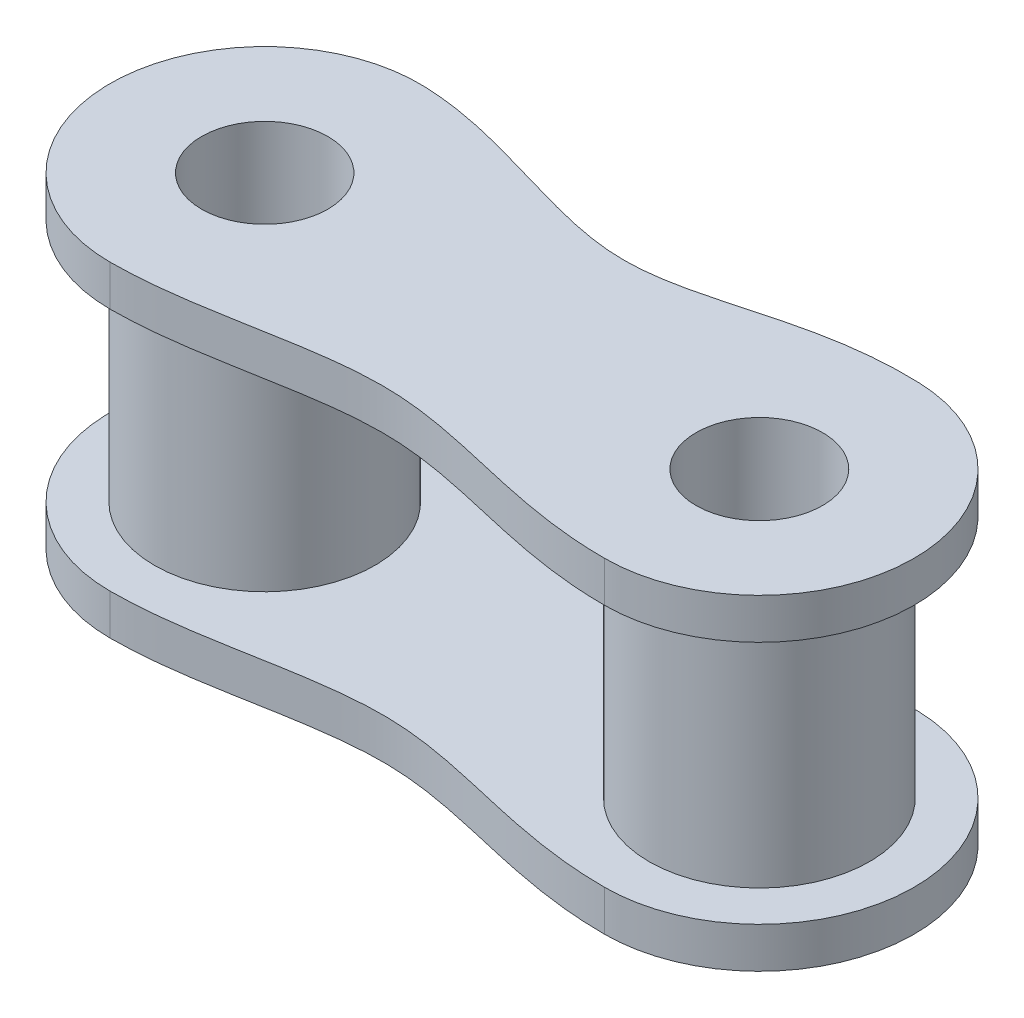
from build123d import *

# Parameters (mm, degrees)
EXTRUDE_8_DEPTH          = 3
EXTRUDE_8_DEPTH_BACK     = 3
SKETCH_3_R               = 2.708293856
EXTRUDE_8_2_DEPTH        = 3
EXTRUDE_8_2_DEPTH_BACK   = 3
CUT_EXTRUDE_1_DEPTH      = 3
CUT_EXTRUDE_1_DEPTH_BACK = 6
SKETCH_4_R               = 1.55
SKETCH_4_R_2             = 1.553894019
SKETCH_7_R               = 1.553894019
SKETCH_7_R_2             = 1.55
EXTRUDE_9_DEPTH          = 1
EXTRUDE_START            = 1
SKETCH_18_R              = 1.55
SKETCH_18_R_2            = 1.553894019
EXTRUDE_17_DEPTH         = 1


with BuildPart() as part:
    # 草图3 → 凸台-拉伸8 (new, two sides: drawn at the far end of the back side and taken through both)
    with BuildSketch(Plane(origin=(0, 0, 0), x_dir=(1, 0, 0), z_dir=(0, 1, 0)).offset(-EXTRUDE_8_DEPTH_BACK)):
        with Locations((-56.235722287, 24.732868077)):
            Circle(SKETCH_3_R)
    extrude(amount=EXTRUDE_8_DEPTH + EXTRUDE_8_DEPTH_BACK)


with BuildPart() as body_2:
    # 草图3 → Extrude 8 2 (new, two sides: drawn at the far end of the back side and taken through both)
    with BuildSketch(Plane(origin=(0, 0, 0), x_dir=(1, 0, 0), z_dir=(0, 1, 0)).offset(-EXTRUDE_8_2_DEPTH_BACK)):
        with Locations((-43.855722287, 24.505707547)):
            Circle(SKETCH_3_R)
    extrude(amount=EXTRUDE_8_2_DEPTH + EXTRUDE_8_2_DEPTH_BACK)


with BuildPart() as cut_extrude_1_tool:
    # 草图4 → 切除-拉伸1 (new, two sides: drawn at the far end of the back side and taken through both)
    with BuildSketch(Plane(origin=(0, 0, 0), x_dir=(1, 0, 0), z_dir=(0, 1, 0)).offset(-CUT_EXTRUDE_1_DEPTH_BACK)):
        with Locations((-56.235722287, 24.732868077)):
            Circle(SKETCH_4_R)
        with Locations((-43.855722287, 24.505707547)):
            Circle(SKETCH_4_R_2)
    extrude(amount=CUT_EXTRUDE_1_DEPTH + CUT_EXTRUDE_1_DEPTH_BACK)


with BuildPart() as part_1:
    add(part.part)

    # 切除-拉伸1: cut by cut_extrude_1_tool
    add(cut_extrude_1_tool.part, mode=Mode.SUBTRACT)



with BuildPart() as body_2_1:
    add(body_2.part)

    # 切除-拉伸1: cut by cut_extrude_1_tool
    add(cut_extrude_1_tool.part, mode=Mode.SUBTRACT)


with BuildPart() as part_2:
    add(part_1.part)

    add(body_2_1.part)  # 凸台-拉伸9 merges body 2
    # 草图7 → 凸台-拉伸9 (add)
    with BuildSketch(Plane.XZ.offset(3)):
        with BuildLine():
            ThreePointArc((-56.235722287, -20.932868077), (-60.035052689, -24.804201821), (-56.093079937, -28.530189917))
            add(Edge.make_bspline(
                [(-56.093079937, -28.530189917), (-53.942583983, -28.449408827), (-49.768599584, -26.149491118), (-46.433977381, -28.398120151), (-43.723017894, -28.303389675)],
                knots=[0, 0, 0, 0, 0.490575379, 1, 1, 1, 1], degree=3))
            ThreePointArc((-43.723017894, -28.303389675), (-40.0563018, -24.43934523), (-43.855722287, -20.705707547))
            add(Edge.make_bspline(
                [(-56.235722287, -20.932868077), (-54.105831048, -20.932868077), (-49.896032342, -22.477788173), (-46.252423284, -20.705707547), (-43.855722287, -20.705707547)],
                knots=[0, 0, 0, 0, 0.498510271, 1, 1, 1, 1], degree=3))
        make_face()
        with Locations((-43.855722287, -24.505707547)):
            Circle(SKETCH_7_R, mode=Mode.SUBTRACT)
        with Locations((-56.235722287, -24.732868077)):
            Circle(SKETCH_7_R_2, mode=Mode.SUBTRACT)
    extrude(amount=EXTRUDE_9_DEPTH)

    # 草图18 → 凸台-拉伸17 (add)
    with BuildSketch(Plane(origin=(0, 3, 0), x_dir=(1, 0, 0), z_dir=(0, 1, 0)).offset(EXTRUDE_START)):
        with BuildLine():
            ThreePointArc((-56.093079937, 28.530189917), (-60.035052689, 24.804201821), (-56.235722287, 20.932868077))
            add(Edge.make_bspline(
                [(-56.235722287, 20.932868077), (-54.105831048, 20.932868077), (-49.896032342, 22.477788173), (-46.252423284, 20.705707547), (-43.855722287, 20.705707547)],
                knots=[0, 0, 0, 0, 0.498510271, 1, 1, 1, 1], degree=3))
            ThreePointArc((-43.855722287, 20.705707547), (-40.0563018, 24.43934523), (-43.723017894, 28.303389675))
            add(Edge.make_bspline(
                [(-43.723017894, 28.303389675), (-46.433977381, 28.398120151), (-49.768599584, 26.149491118), (-53.942583983, 28.449408827), (-56.093079937, 28.530189917)],
                knots=[0, 0, 0, 0, 0.509424621, 1, 1, 1, 1], degree=3))
        make_face()
        with Locations((-56.235722287, 24.732868077)):
            Circle(SKETCH_18_R, mode=Mode.SUBTRACT)
        with Locations((-43.855722287, 24.505707547)):
            Circle(SKETCH_18_R_2, mode=Mode.SUBTRACT)
    extrude(amount=-EXTRUDE_17_DEPTH)


solid = part_2.part
